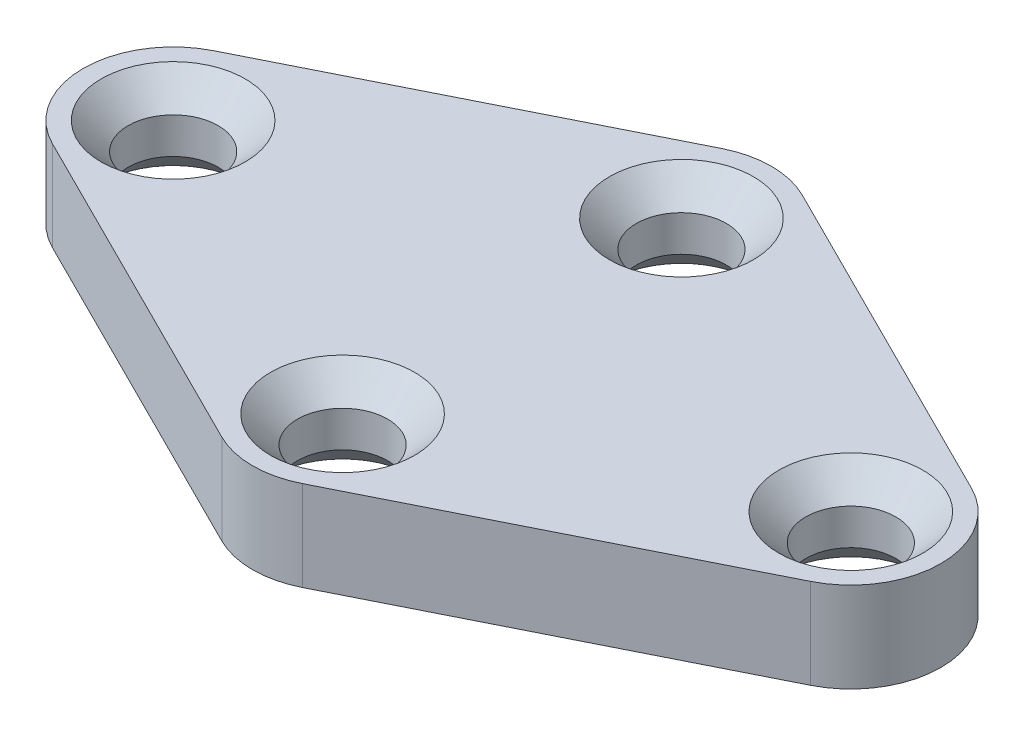
from build123d import *

# Parameters (mm, degrees)
SKETCH1_R           = 5
BOSS_EXTRUDE1_DEPTH = 10
CHAMFER1_SIZE       = 3


with BuildPart() as part:
    # Sketch1 → Boss-Extrude1 (new body)
    with BuildSketch(Plane(origin=(0, 0, 0), x_dir=(1, 0, 0), z_dir=(0, 1, 0))):
        with BuildLine():
            Line((-4.472135955, 27.763932023), (-42.11145618, 8.94427191))
            ThreePointArc((-42.11145618, 8.94427191), (-47.639320225, 0), (-42.11145618, -8.94427191))
            Line((-42.11145618, -8.94427191), (-4.472135955, -27.763932023))
            ThreePointArc((-4.472135955, -27.763932023), (0, -28.819660113), (4.472135955, -27.763932023))
            Line((4.472135955, -27.763932023), (42.11145618, -8.94427191))
            ThreePointArc((42.11145618, -8.94427191), (47.639320225, 0), (42.11145618, 8.94427191))
            Line((42.11145618, 8.94427191), (4.472135955, 27.763932023))
            ThreePointArc((4.472135955, 27.763932023), (0, 28.819660113), (-4.472135955, 27.763932023))
        make_face()
        with Locations(Location((0, 18.819660113, 0), (0, 0, 270))):
            Circle(SKETCH1_R, mode=Mode.SUBTRACT)
        with Locations(Location((37.639320225, 0, 0), (0, 0, 270))):
            Circle(SKETCH1_R, mode=Mode.SUBTRACT)
        with Locations(Location((0, -18.819660113, 0), (0, 0, 270))):
            Circle(SKETCH1_R, mode=Mode.SUBTRACT)
        with Locations(Location((-37.639320225, 0, 0), (0, 0, 270))):
            Circle(SKETCH1_R, mode=Mode.SUBTRACT)
    extrude(amount=BOSS_EXTRUDE1_DEPTH)

    # Chamfer1
    chamfer1_edges = [part.edges().sort_by_distance(p)[0] for p in [
        (0, 0, -23.819660113),
        (0, 10, -23.819660113),
        (37.639320225, 0, -5),
        (37.639320225, 10, -5),
        (0, 0, 13.819660113),
        (0, 10, 13.819660113),
        (-37.639320225, 0, -5),
        (-37.639320225, 10, -5),
    ]]
    chamfer(chamfer1_edges, length=CHAMFER1_SIZE)


solid = part.part
